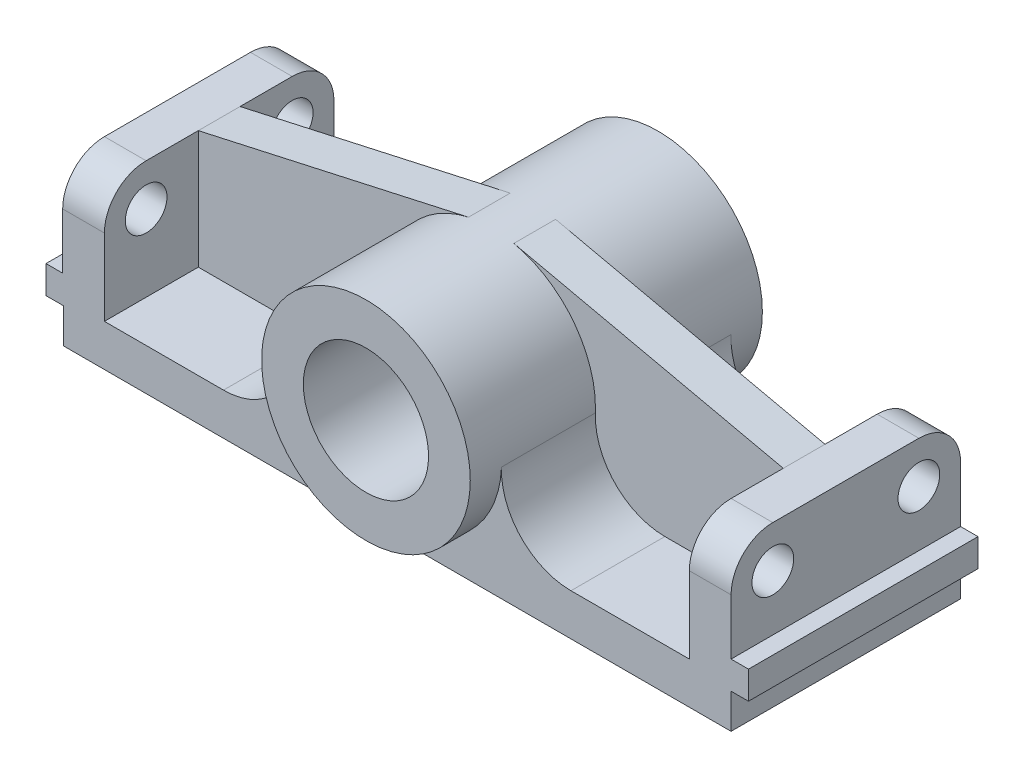
from build123d import *

# Parameters (mm, degrees)
SKETCH1_R                      = 30
SKETCH1_R_2                    = 18
BOSS_EXTRUDE1_DEPTH            = 84
BOSS_EXTRUDE3_DEPTH            = 66
CUT_EXTRUDE1_REACH             = 218.843
SKETCH3_R                      = 6
CUT_EXTRUDE1_DIRECTION_2_DEPTH = 217.843261366
FILLET1_R                      = 12
CUT_EXTRUDE2_REACH             = 219.029
SKETCH4_R                      = 6
FILLET2_R                      = 12
RIB1_REACH                     = 116.547
SKETCH5_WALL_W                 = 310.682445014
SKETCH5_WALL_H                 = 12
RIB2_REACH                     = 116.547
SKETCH6_WALL_W                 = 310.466406556
SKETCH6_WALL_H                 = 12


with BuildPart() as part:
    # Sketch1 → Boss-Extrude1 (new body)
    with BuildSketch(Plane.XY):
        with Locations(Location((0, 0, 0), (0, 0, 180))):
            Circle(SKETCH1_R)
        with Locations(Location((0, 0, 0), (0, 0, 180))):
            Circle(SKETCH1_R_2, mode=Mode.SUBTRACT)
    extrude(amount=BOSS_EXTRUDE1_DEPTH)

    # Sketch2 → Boss-Extrude3 (add)
    with BuildSketch(Plane.XY.offset(9)):
        with BuildLine():
            Line((96, -24), (101, -24))
            Line((101, -24), (101, -16))
            Line((101, -16), (96, -16))
            Line((96, -16), (96, 12))
            Line((96, 12), (84, 12))
            Line((84, 12), (84, -22))
            Line((84, -22), (49.959983987, -22))
            ThreePointArc((49.959983987, -22), (35.537778885, -15.856406461), (29.975990392, -1.2))
            ThreePointArc((29.975990392, -1.2), (0, -30), (-29.975990392, -1.2))
            ThreePointArc((-29.975990392, -1.2), (-35.537778885, -15.856406461), (-49.959983987, -22))
            Line((-49.959983987, -22), (-84.204166847, -22))
            Line((-84.204166847, -22), (-84.204166847, 12))
            Line((-84.204166847, 12), (-96.204166847, 12))
            Line((-96.204166847, 12), (-96.204166847, -16))
            Line((-96.204166847, -16), (-101, -16))
            Line((-101, -16), (-101, -24))
            Line((-101, -24), (-96, -24))
            Line((-96, -24), (-96, -34))
            Line((-96, -34), (96, -34))
            Line((96, -34), (96, -24))
        make_face()
    extrude(amount=BOSS_EXTRUDE3_DEPTH)

    # Sketch3 → Cut-Extrude1 (cut, up to next)
    with BuildSketch(Plane(origin=(96, 0, 0), x_dir=(0, 0, -1), z_dir=(1, 0, 0)), mode=Mode.PRIVATE) as cut_extrude1_sk1:
        with Locations(Location((-63, 0, 0), (0, 0, 180))):
            Circle(SKETCH3_R)
    cut_extrude1_tool1 = extrude(cut_extrude1_sk1.sketch, amount=-CUT_EXTRUDE1_REACH, mode=Mode.PRIVATE) & part.part
    # Sketch3 → Cut-Extrude1 (cut, up to next)
    with BuildSketch(Plane(origin=(96, 0, 0), x_dir=(0, 0, -1), z_dir=(1, 0, 0)), mode=Mode.PRIVATE) as cut_extrude1_sk2:
        with Locations(Location((-21, 0, 0), (0, 0, 180))):
            Circle(SKETCH3_R)
    cut_extrude1_tool2 = extrude(cut_extrude1_sk2.sketch, amount=-CUT_EXTRUDE1_REACH, mode=Mode.PRIVATE) & part.part
    add(cut_extrude1_tool1.solids().sort_by_distance((96, 0, 63))[0], mode=Mode.SUBTRACT)
    add(cut_extrude1_tool2.solids().sort_by_distance((96, 0, 21))[0], mode=Mode.SUBTRACT)

    # Sketch3 → Cut-Extrude1 direction 2 (cut)
    with BuildSketch(Plane(origin=(96, 0, 0), x_dir=(0, 0, -1), z_dir=(1, 0, 0))):
        with Locations(Location((-63, 0, 0), (0, 0, 180))):
            Circle(SKETCH3_R)
        with Locations(Location((-21, 0, 0), (0, 0, 180))):
            Circle(SKETCH3_R)
    extrude(amount=CUT_EXTRUDE1_DIRECTION_2_DEPTH, mode=Mode.SUBTRACT)

    # Fillet1
    fillet1_edges = [part.edges().sort_by_distance(p)[0] for p in [
        (90, 12, 9),
        (90, 12, 75),
    ]]
    fillet(fillet1_edges, radius=FILLET1_R)

    # Sketch4 → Cut-Extrude2 (cut, up to next)
    with BuildSketch(Plane.ZY.offset(96.204166847), mode=Mode.PRIVATE) as cut_extrude2_sk1:
        with Locations((21, 0)):
            Circle(SKETCH4_R)
    cut_extrude2_tool1 = extrude(cut_extrude2_sk1.sketch, amount=-CUT_EXTRUDE2_REACH, mode=Mode.PRIVATE) & part.part
    # Sketch4 → Cut-Extrude2 (cut, up to next)
    with BuildSketch(Plane.ZY.offset(96.204166847), mode=Mode.PRIVATE) as cut_extrude2_sk2:
        with Locations((63, 0)):
            Circle(SKETCH4_R)
    cut_extrude2_tool2 = extrude(cut_extrude2_sk2.sketch, amount=-CUT_EXTRUDE2_REACH, mode=Mode.PRIVATE) & part.part
    add(cut_extrude2_tool1.solids().sort_by_distance((-96.204167, 0, 21))[0], mode=Mode.SUBTRACT)
    add(cut_extrude2_tool2.solids().sort_by_distance((-96.204167, 0, 63))[0], mode=Mode.SUBTRACT)

    # Fillet2
    fillet2_edges = [part.edges().sort_by_distance(p)[0] for p in [
        (-90.204166847, 12, 9),
        (-90.204166847, 12, 75),
    ]]
    fillet(fillet2_edges, radius=FILLET2_R)

    # Sketch5 wall → Rib1 (add, up to next)
    with BuildSketch(Plane(origin=(-45.359592124, 20.642016154, 42), x_dir=(0.976134410289, 0.217167246725, 0), z_dir=(-0.217167246725, 0.976134410289, 0)), mode=Mode.PRIVATE) as rib1_sk1:
        Rectangle(SKETCH5_WALL_W, SKETCH5_WALL_H)
    rib1_tool1 = extrude(rib1_sk1.sketch, amount=-RIB1_REACH, mode=Mode.PRIVATE) - part.part
    add(rib1_tool1.solids().sort_by_distance((-45.359592124, 20.642016154, 42))[0])

    # Sketch6 wall → Rib2 (add, up to next)
    with BuildSketch(Plane(origin=(45.265686516, 20.640194383, 42), x_dir=(-0.976012958873, 0.217712434444, 0), z_dir=(-0.217712434444, -0.976012958873, 0)), mode=Mode.PRIVATE) as rib2_sk1:
        Rectangle(SKETCH6_WALL_W, SKETCH6_WALL_H)
    rib2_tool1 = extrude(rib2_sk1.sketch, amount=RIB2_REACH, mode=Mode.PRIVATE) - part.part
    add(rib2_tool1.solids().sort_by_distance((45.265686516, 20.640194383, 42))[0])


solid = part.part
